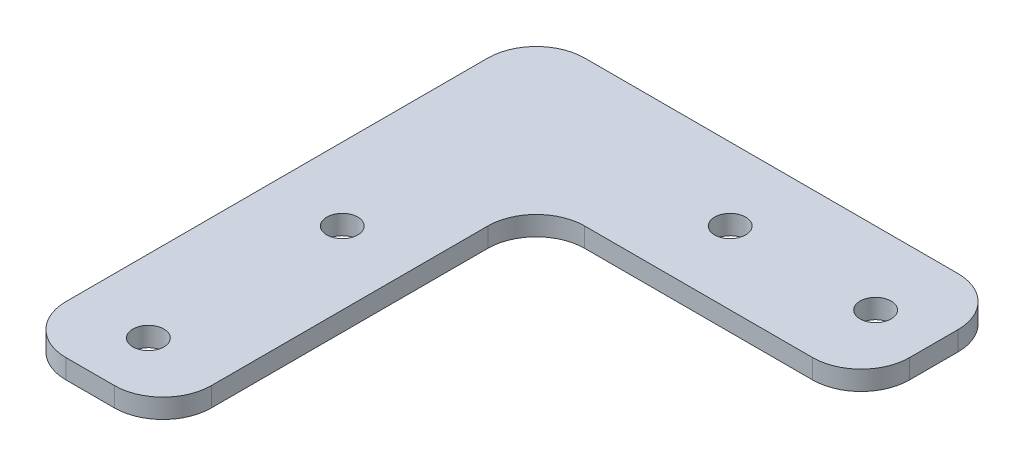
from build123d import *

# Parameters (mm, degrees)
SKETCH1_R           = 1.6
BOSS_EXTRUDE1_DEPTH = 2
FILLET1_R           = 5


with BuildPart() as part:
    # Sketch1 → Boss-Extrude1 (new body)
    with BuildSketch(Plane(origin=(0, 0, 0), x_dir=(1, 0, 0), z_dir=(0, 1, 0))):
        Polygon((7.5, -7.5), (7.5, -46), (-7.5, -46), (-7.5, 7.5), (41, 7.5), (41, -7.5), align=None)
        with Locations(Location((0, -40, 0), (0, 0, 270))):
            Circle(SKETCH1_R, mode=Mode.SUBTRACT)
        with Locations(Location((0, -20, 0), (0, 0, 270))):
            Circle(SKETCH1_R, mode=Mode.SUBTRACT)
        with Locations(Location((20, 0, 0), (0, 0, 90))):
            Circle(SKETCH1_R, mode=Mode.SUBTRACT)
        with Locations(Location((35, 0, 0), (0, 0, 90))):
            Circle(SKETCH1_R, mode=Mode.SUBTRACT)
    extrude(amount=BOSS_EXTRUDE1_DEPTH)

    # Fillet1
    fillet1_edges = [part.edges().sort_by_distance(p)[0] for p in [
        (7.5, 1, 7.5),
        (7.5, 1, 46),
        (-7.5, 1, 46),
        (-7.5, 1, -7.5),
        (41, 1, -7.5),
        (41, 1, 7.5),
    ]]
    fillet(fillet1_edges, radius=FILLET1_R)


solid = part.part
